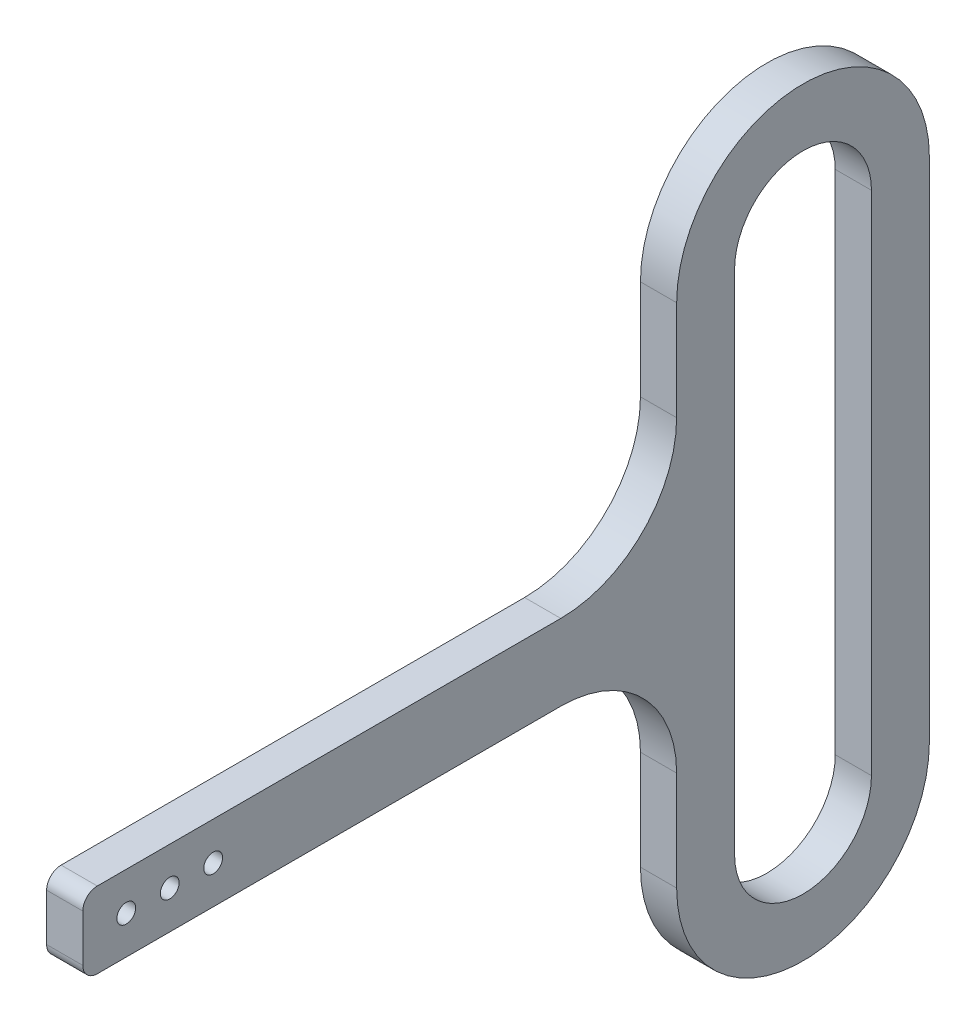
from build123d import *

# Parameters (mm, degrees)
SKETCH2_R           = 1.651
BOSS_EXTRUDE2_DEPTH = 6.35
FILLET2_R           = 20.32
FILLET3_R           = 2.54


with BuildPart() as part:
    # Sketch2 → Boss-Extrude2 (new body)
    with BuildSketch(Plane(origin=(0, 0, 0), x_dir=(0, 0, -1), z_dir=(1, 0, 0))):
        with BuildLine():
            Line((-22.16, -6.6675), (-22.16, -44.45))
            ThreePointArc((-22.16, -44.45), (0, -66.61), (22.16, -44.45))
            Line((22.16, -44.45), (22.16, 44.45))
            ThreePointArc((22.16, 44.45), (0, 66.61), (-22.16, 44.45))
            Line((-22.16, 44.45), (-22.16, 6.6675))
            Line((-22.16, 6.6675), (-126.3, 6.6675))
            Line((-126.3, 6.6675), (-126.3, -6.6675))
            Line((-126.3, -6.6675), (-22.16, -6.6675))
        make_face()
        with BuildLine():
            ThreePointArc((12, -44.45), (0, -56.45), (-12, -44.45))
            Line((-12, -44.45), (-12, 44.45))
            ThreePointArc((-12, 44.45), (0, 56.45), (12, 44.45))
            Line((12, 44.45), (12, -44.45))
        make_face(mode=Mode.SUBTRACT)
        with Locations((-111.06, 0)):
            Circle(SKETCH2_R, mode=Mode.SUBTRACT)
        with Locations((-103.44, 0)):
            Circle(SKETCH2_R, mode=Mode.SUBTRACT)
        with Locations((-118.68, 0)):
            Circle(SKETCH2_R, mode=Mode.SUBTRACT)
    extrude(amount=BOSS_EXTRUDE2_DEPTH)

    # Fillet2
    fillet2_edges = [part.edges().sort_by_distance(p)[0] for p in [
        (3.175, 6.6675, 22.16),
        (3.175, -6.6675, 22.16),
    ]]
    fillet(fillet2_edges, radius=FILLET2_R)

    # Fillet3
    fillet3_edges = [part.edges().sort_by_distance(p)[0] for p in [
        (3.175, 6.6675, 126.3),
        (3.175, -6.6675, 126.3),
    ]]
    fillet(fillet3_edges, radius=FILLET3_R)


solid = part.part
